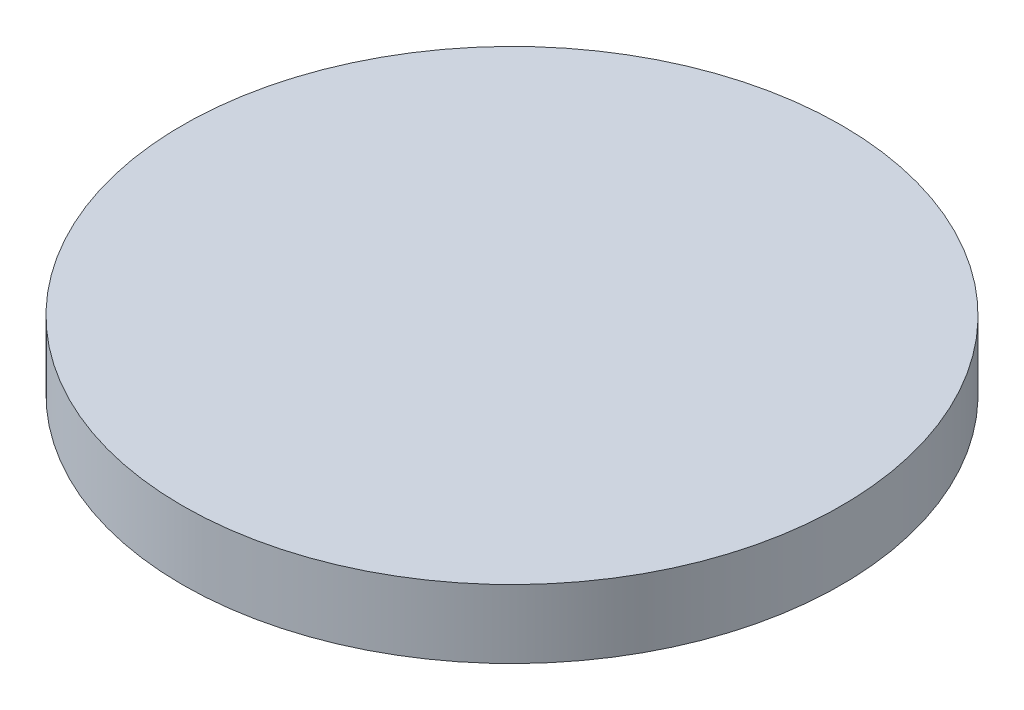
from build123d import *

# Parameters (mm, degrees)
SKETCH1_R           = 14.45
BOSS_EXTRUDE1_DEPTH = 3


with BuildPart() as part:
    # Sketch1 → Boss-Extrude1 (new body)
    with BuildSketch(Plane(origin=(0, 0, 0), x_dir=(1, 0, 0), z_dir=(0, 1, 0))):
        with Locations(Location((0, 0, 0), (0, 0, 270))):
            Circle(SKETCH1_R)
    extrude(amount=BOSS_EXTRUDE1_DEPTH)


solid = part.part
